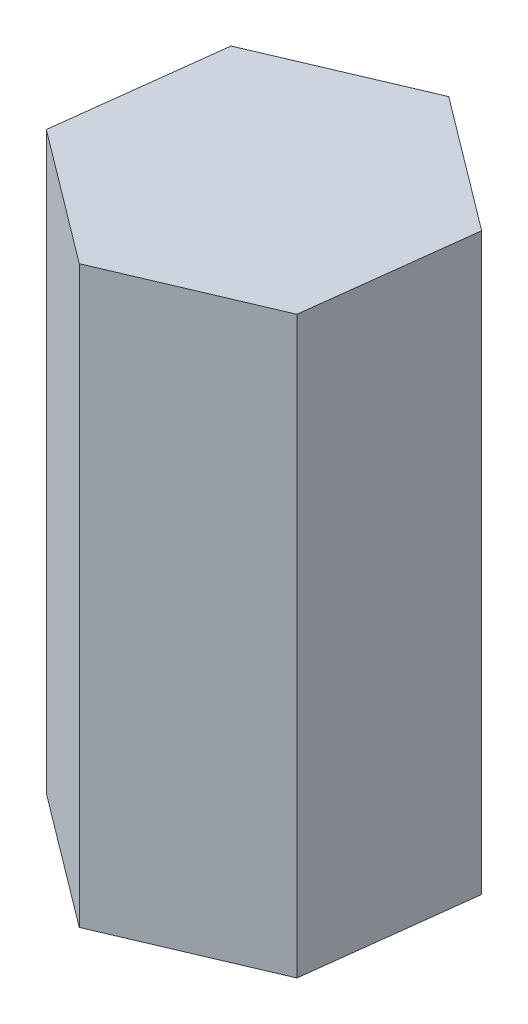
from build123d import *

# Parameters (mm, degrees)
BOSS_EXTRUDE1_DEPTH = 10


with BuildPart() as part:
    # Sketch1 → Boss-Extrude1 (new body)
    with BuildSketch(Plane(origin=(0, 0, 0), x_dir=(1, 0, 0), z_dir=(0, 1, 0))):
        Polygon((2.307490026, -1.734595951), (2.655949172, 1.131047006), (0.348459146, 2.865642957), (-2.307490026, 1.734595951), (-2.655949172, -1.131047006), (-0.348459146, -2.865642957), align=None)
    extrude(amount=BOSS_EXTRUDE1_DEPTH)


solid = part.part
